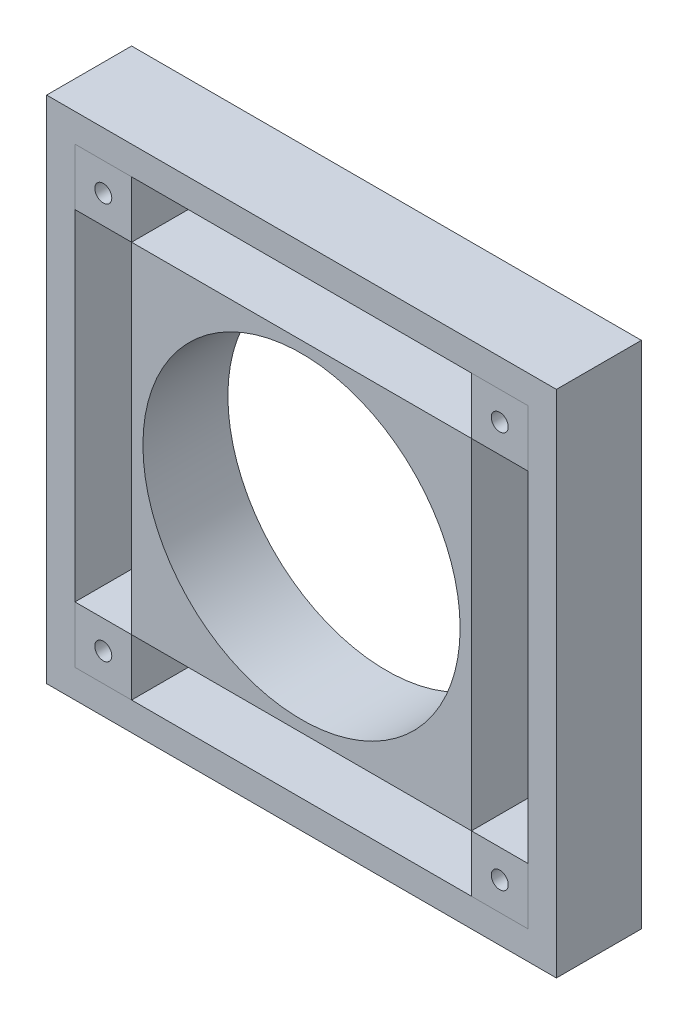
from build123d import *

# Parameters (mm, degrees)
SKETCH2_W               = 90
SKETCH2_H               = 90
BOSS_EXTRUDE1_DEPTH     = 15
SKETCH3_W               = 80
SKETCH3_H               = 80
SKETCH3_W_2             = 60
SKETCH3_H_2             = 60
CUT_EXTRUDE1_DEPTH      = 10
SKETCH4_W               = 10
SKETCH4_H               = 10
BOSS_EXTRUDE5_DEPTH     = 10
CIRPATTERN3_COUNT       = 4
SKETCH5_R               = 28
CUT_EXTRUDE2_DEPTH      = 129.16005618
SKETCH6_R               = 1.5
CUT_EXTRUDE3_DEPTH      = 129.16005618
MIRROR2_COPY_1_SKETCH_R = 1.5
MIRROR2_COPY_1_DEPTH    = 129.16005618


with BuildPart() as part:
    # Sketch2 → Boss-Extrude1 (new body)
    with BuildSketch(Plane.XY):
        with Locations((45, 45)):
            Rectangle(SKETCH2_W, SKETCH2_H)
    extrude(amount=BOSS_EXTRUDE1_DEPTH)

    # Sketch3 → Cut-Extrude1 (cut)
    with BuildSketch(Plane.XY.offset(15)):
        with Locations((45, 45)):
            Rectangle(SKETCH3_W, SKETCH3_H)
        with Locations((45, 45)):
            Rectangle(SKETCH3_W_2, SKETCH3_H_2, mode=Mode.SUBTRACT)
    extrude(amount=-CUT_EXTRUDE1_DEPTH, mode=Mode.SUBTRACT)

    # Sketch5 → Cut-Extrude2 (cut, through all)
    with BuildSketch(Plane.XY.offset(15)):
        with Locations((45, 45)):
            Circle(SKETCH5_R)
    extrude(amount=-CUT_EXTRUDE2_DEPTH, mode=Mode.SUBTRACT)


with BuildPart() as body_2:
    # Sketch4 → Boss-Extrude5 (new, through all)
    with BuildSketch(Plane.XY.offset(5)):
        with Locations((10, 80)):
            Rectangle(SKETCH4_W, SKETCH4_H)
    extrude(amount=BOSS_EXTRUDE5_DEPTH)


with BuildPart() as cirpattern3_1:
    # CirPattern3: pattern copy
    add(body_2.part.rotate(Axis((45, 45, 0), (0, 0, 1)), 1 * 360 / CIRPATTERN3_COUNT))


with BuildPart() as cirpattern3_2:
    # CirPattern3: pattern copy
    add(body_2.part.rotate(Axis((45, 45, 0), (0, 0, 1)), 2 * 360 / CIRPATTERN3_COUNT))


with BuildPart() as cirpattern3_3:
    # CirPattern3: pattern copy
    add(body_2.part.rotate(Axis((45, 45, 0), (0, 0, 1)), 3 * 360 / CIRPATTERN3_COUNT))


with BuildPart() as cut_extrude3_tool:
    # Sketch6 → Cut-Extrude3 (new, through all)
    with BuildSketch(Plane.XY.offset(15)):
        with Locations((10, 80)):
            Circle(SKETCH6_R)
    cut_extrude3 = extrude(amount=-CUT_EXTRUDE3_DEPTH)


with BuildPart() as part_1:
    add(part.part)

    # Cut-Extrude3: cut by cut_extrude3_tool
    add(cut_extrude3_tool.part, mode=Mode.SUBTRACT)


with BuildPart() as body_2_1:
    add(body_2.part)

    # Cut-Extrude3: cut by cut_extrude3_tool
    add(cut_extrude3_tool.part, mode=Mode.SUBTRACT)


with BuildPart() as mirror1_tool:
    # Mirror1: Cut-Extrude3 across plane
    add(cut_extrude3.mirror(Plane(origin=(0, 45, 0), x_dir=(0, 0, 1), z_dir=(0, -1, 0))))


with BuildPart() as part_2:
    add(part_1.part)

    # Mirror1: cut by mirror1_tool
    add(mirror1_tool.part, mode=Mode.SUBTRACT)


with BuildPart() as cirpattern3_1_1:
    add(cirpattern3_1.part)

    # Mirror1: cut by mirror1_tool
    add(mirror1_tool.part, mode=Mode.SUBTRACT)


with BuildPart() as mirror2_tool:
    # Mirror2: Cut-Extrude3 across plane
    add(cut_extrude3.mirror(Plane.ZY.offset(-45)))


with BuildPart() as part_3:
    add(part_2.part)

    # Mirror2: cut by mirror2_tool
    add(mirror2_tool.part, mode=Mode.SUBTRACT)


with BuildPart() as cirpattern3_3_1:
    add(cirpattern3_3.part)

    # Mirror2: cut by mirror2_tool
    add(mirror2_tool.part, mode=Mode.SUBTRACT)


with BuildPart() as mirror2_copy_1_tool:
    # Mirror2 copy 1 sketch → Mirror2 copy 1 (new, through all)
    with BuildSketch(Plane(origin=(90, 90, 15), x_dir=(-1, 0, 0), z_dir=(0, 0, 1))):
        with Locations((10, 80)):
            Circle(MIRROR2_COPY_1_SKETCH_R)
    extrude(amount=-MIRROR2_COPY_1_DEPTH)


with BuildPart() as part_4:
    add(part_3.part)

    # Mirror2 copy 1: cut by mirror2_copy_1_tool
    add(mirror2_copy_1_tool.part, mode=Mode.SUBTRACT)


with BuildPart() as cirpattern3_2_1:
    add(cirpattern3_2.part)

    # Mirror2 copy 1: cut by mirror2_copy_1_tool
    add(mirror2_copy_1_tool.part, mode=Mode.SUBTRACT)


solid = Compound([body_2_1.part, cirpattern3_1_1.part, cirpattern3_3_1.part, part_4.part, cirpattern3_2_1.part])
